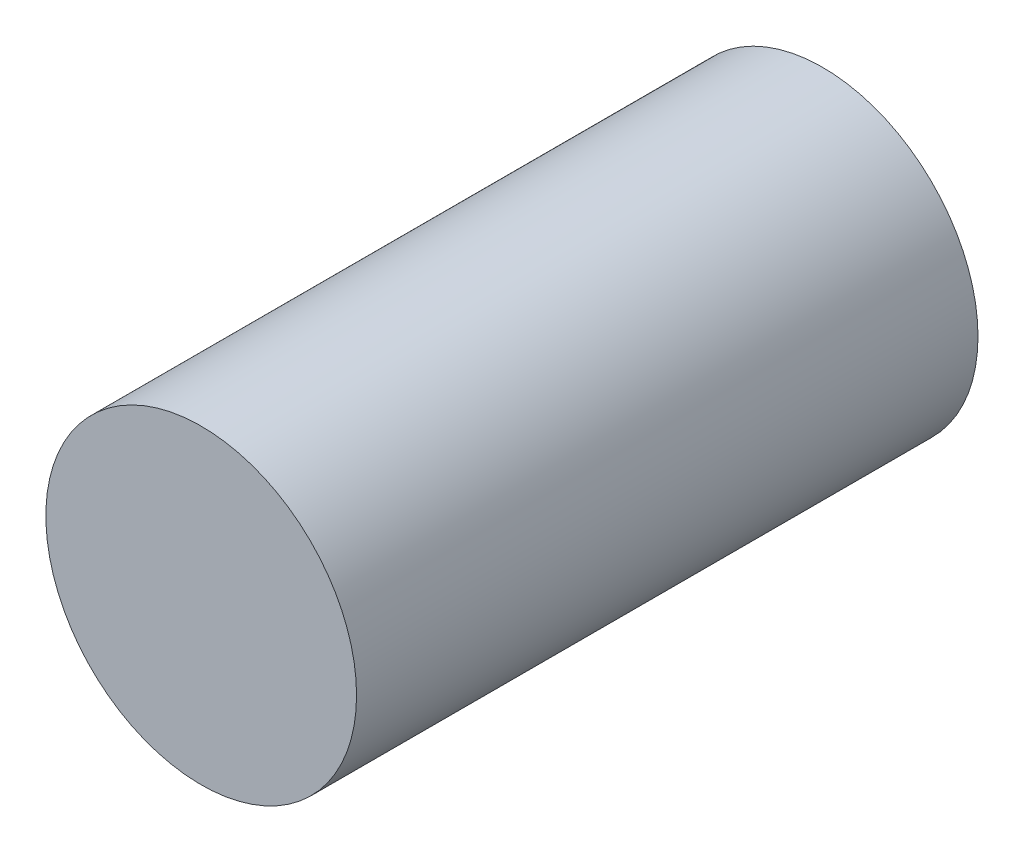
from build123d import *

# Parameters (mm, degrees)
SKETCH2_R           = 50
BOSS_EXTRUDE1_DEPTH = 200


with BuildPart() as part:
    # Sketch2 → Boss-Extrude1 (new body)
    with BuildSketch(Plane.XY):
        Circle(SKETCH2_R)
    extrude(amount=BOSS_EXTRUDE1_DEPTH)


solid = part.part
